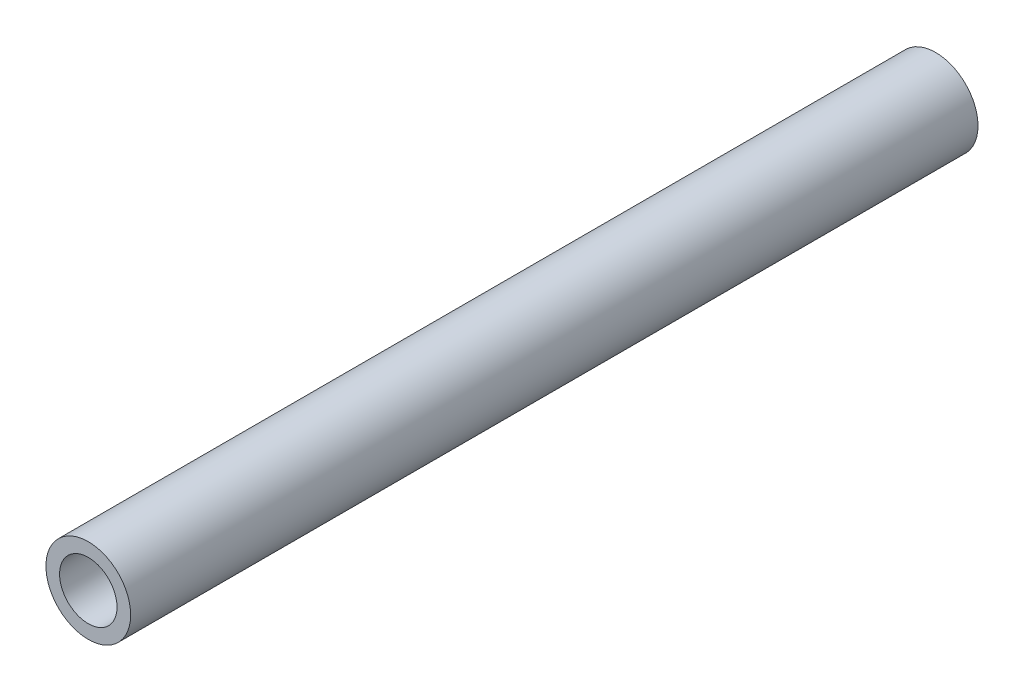
from build123d import *

# Parameters (mm, degrees)
SKETCH1_R           = 3.175
SKETCH1_R_2         = 2.15265
BOSS_EXTRUDE1_DEPTH = 31.75


with BuildPart() as part:
    # Sketch1 → Boss-Extrude1 (new, symmetric)
    with BuildSketch(Plane.XY):
        Circle(SKETCH1_R)
        Circle(SKETCH1_R_2, mode=Mode.SUBTRACT)
    extrude(amount=BOSS_EXTRUDE1_DEPTH, both=True)


solid = part.part
